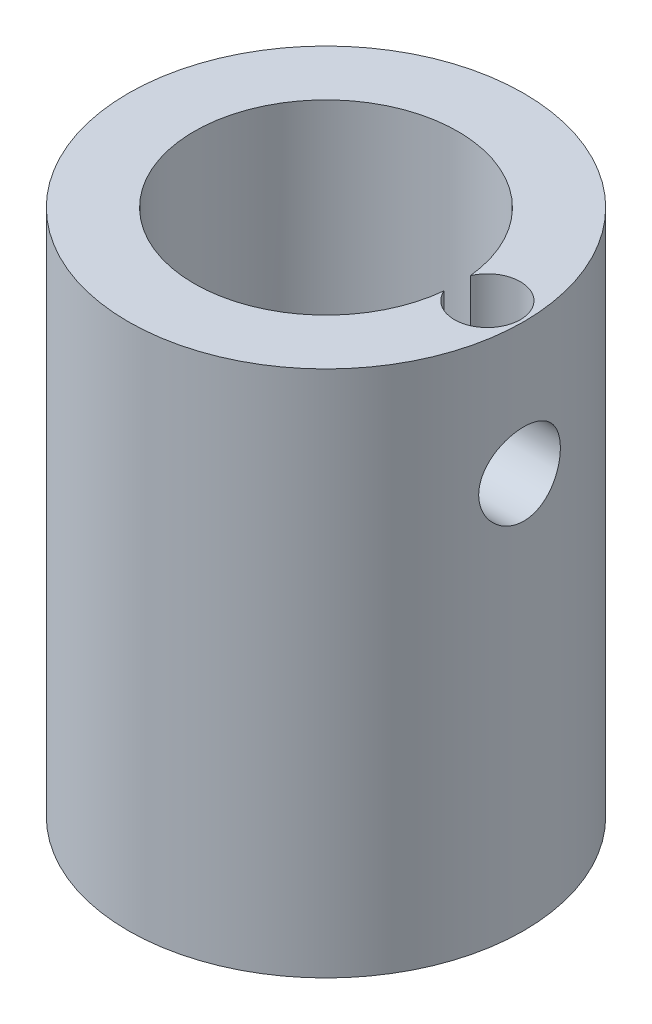
from build123d import *

# Parameters (mm, degrees)
SKETCH1_R           = 30
BOSS_EXTRUDE1_DEPTH = 80
SKETCH2_R           = 20
CUT_EXTRUDE2_DEPTH  = 77
SKETCH3_R           = 5
CUT_EXTRUDE3_DEPTH  = 20
SKETCH6_R           = 6.195708911
CUT_EXTRUDE6_DEPTH  = 40


with BuildPart() as part:
    # Sketch1 → Boss-Extrude1 (new body)
    with BuildSketch(Plane(origin=(0, 0, 0), x_dir=(1, 0, 0), z_dir=(0, 1, 0))):
        with Locations(Location((0, 0, 0), (0, 0, 270))):
            Circle(SKETCH1_R)
    extrude(amount=BOSS_EXTRUDE1_DEPTH)

    # Sketch2 → Cut-Extrude2 (cut)
    with BuildSketch(Plane(origin=(0, 80, 0), x_dir=(1, 0, 0), z_dir=(0, 1, 0))):
        with Locations(Location((0, 0, 0), (0, 0, 270))):
            Circle(SKETCH2_R)
    extrude(amount=-CUT_EXTRUDE2_DEPTH, mode=Mode.SUBTRACT)

    # Sketch3 → Cut-Extrude3 (cut)
    with BuildSketch(Plane(origin=(0, 80, 0), x_dir=(1, 0, 0), z_dir=(0, 1, 0))):
        with Locations((24.479648354, 0)):
            Circle(SKETCH3_R)
    extrude(amount=-CUT_EXTRUDE3_DEPTH, mode=Mode.SUBTRACT)

    # Sketch6 → Cut-Extrude6 (cut)
    with BuildSketch(Plane(origin=(0, 0, 0), x_dir=(0, 0, -1), z_dir=(1, 0, 0))):
        with Locations(Location((0, 60, 0), (0, 0, 180))):
            Circle(SKETCH6_R)
    extrude(amount=CUT_EXTRUDE6_DEPTH, mode=Mode.SUBTRACT)


solid = part.part
